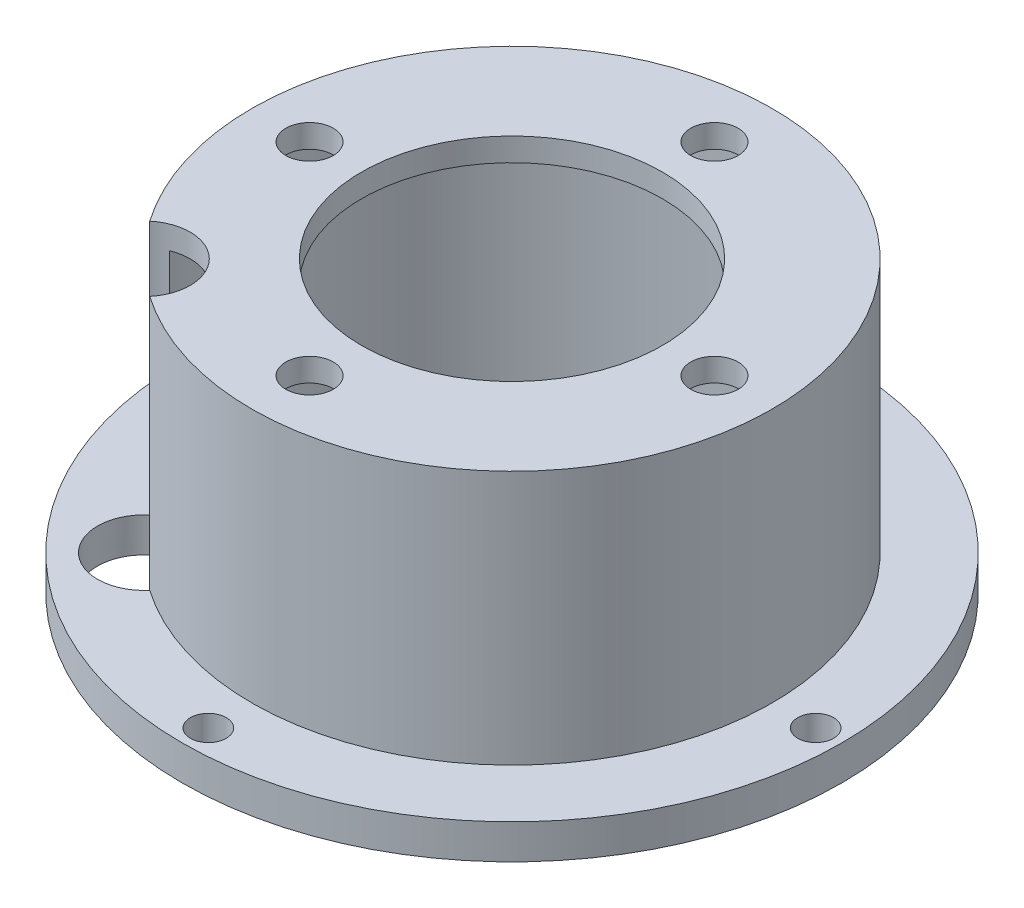
from build123d import *

# Parameters (mm, degrees)
SKETCH_2_R          = 2.05
CUT_EXTRUDE_1_DEPTH = 10
SKETCH_3_R          = 1.55
CUT_EXTRUDE_3_DEPTH = 48.428894147
SKETCH_20_R         = 4
CUT_EXTRUDE_4_DEPTH = 29


with BuildPart() as part:
    # 草图1 → 旋转1 (revolve)
    with BuildSketch(Plane(origin=(0, 0, 0), x_dir=(0, 0, -1), z_dir=(1, 0, 0))):
        Polygon((13, 25), (13, 23), (21.25, 23), (21.25, 0), (28.5, 0), (28.5, 3), (22.5, 3), (22.5, 25), align=None)
    revolve(axis=Axis((0, 0, 0), (0, 1, 0)))

    # 草图2 → 切除-拉伸1 (cut)
    with BuildSketch(Plane(origin=(0, 25, 0), x_dir=(1, 0, 0), z_dir=(0, 1, 0))):
        with Locations(Location((0, 17.5, 0), (0, 0, 270))):
            Circle(SKETCH_2_R)
        with Locations(Location((17.5, 0, 0), (0, 0, 270))):
            Circle(SKETCH_2_R)
        with Locations(Location((0, -17.5, 0), (0, 0, 270))):
            Circle(SKETCH_2_R)
        with Locations(Location((-17.5, 0, 0), (0, 0, 270))):
            Circle(SKETCH_2_R)
    extrude(amount=-CUT_EXTRUDE_1_DEPTH, mode=Mode.SUBTRACT)

    # 草图3 → 切除-拉伸3 (cut, through all)
    with BuildSketch(Plane(origin=(0, 0, 0), x_dir=(1, 0, 0), z_dir=(0, 1, 0))):
        with Locations(Location((0, -26.25, 0), (0, 0, 270))):
            Circle(SKETCH_3_R)
        with Locations(Location((-26.25, 0, 0), (0, 0, 270))):
            Circle(SKETCH_3_R)
        with Locations(Location((0, 26.25, 0), (0, 0, 270))):
            Circle(SKETCH_3_R)
        with Locations(Location((26.25, 0, 0), (0, 0, 270))):
            Circle(SKETCH_3_R)
    extrude(amount=CUT_EXTRUDE_3_DEPTH, mode=Mode.SUBTRACT)

    # 草图20 → 切除-拉伸4 (cut)
    with BuildSketch(Plane(origin=(0, 25, 0), x_dir=(1, 0, 0), z_dir=(0, 1, 0))):
        with Locations(Location((-15.909902577, -15.909902577, 0), (0, 0, 320.099688914))):
            Circle(SKETCH_20_R)
    extrude(amount=-CUT_EXTRUDE_4_DEPTH, mode=Mode.SUBTRACT)


solid = part.part
